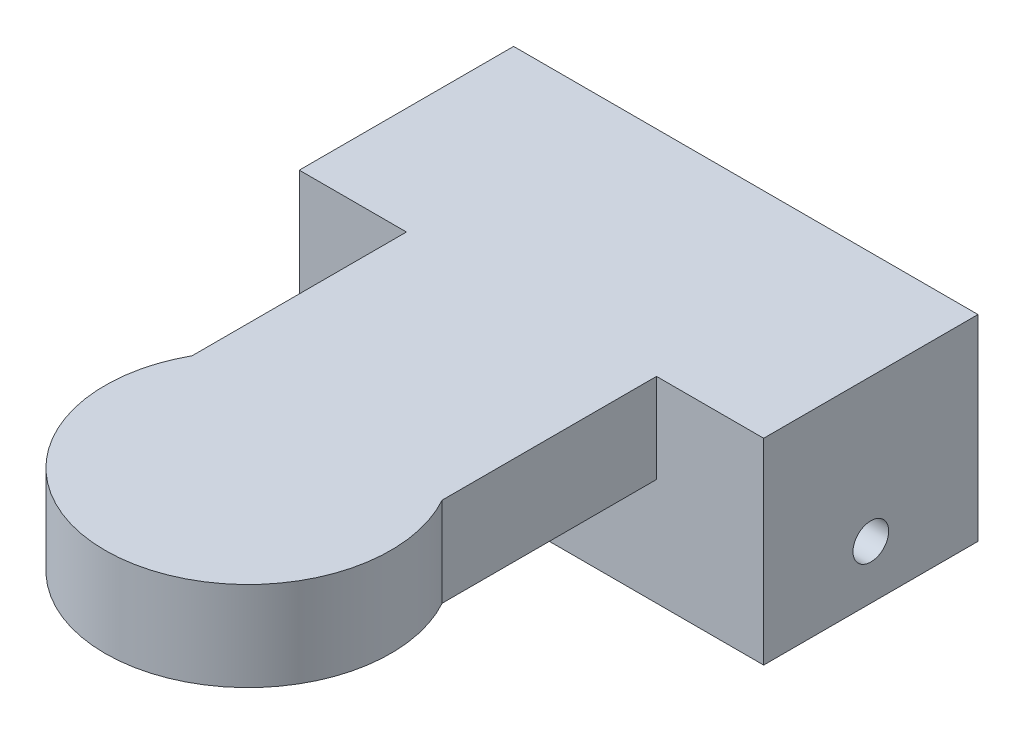
from build123d import *

# Parameters (mm, degrees)
SKETCH1_R                = 20
BOSS_EXTRUDE1_DEPTH      = 10
CUT_EXTRUDE1_DEPTH       = 31
BOSS_EXTRUDE2_DEPTH      = 10
SKETCH5_R                = 12.5
BOSS_EXTRUDE3_DEPTH      = 6
BOSS_EXTRUDE4_DEPTH      = 10
BOSS_EXTRUDE4_DEPTH_BACK = 20
SKETCH7_R                = 2.5
CUT_EXTRUDE2_DEPTH       = 97.465771152
BOSS_EXTRUDE5_DEPTH      = 2.5
CUT_EXTRUDE3_START       = -2.5
SKETCH9_R                = 12.5
CUT_EXTRUDE3_DEPTH       = 2.5
SKETCH10_W               = 45
SKETCH10_H               = 15
BOSS_EXTRUDE6_DEPTH      = 9.95
SKETCH11_W               = 45
SKETCH11_H               = 15
BOSS_EXTRUDE7_DEPTH      = 9.95
SKETCH12_R               = 47.5
CUT_EXTRUDE4_DEPTH       = 10


with BuildPart() as part:
    # Sketch1 → Boss-Extrude1 (new body)
    with BuildSketch(Plane(origin=(0, 0, 0), x_dir=(1, 0, 0), z_dir=(0, 1, 0))):
        with Locations(Location((0, 0, 0), (0, 0, 270))):
            Circle(SKETCH1_R)
    extrude(amount=BOSS_EXTRUDE1_DEPTH)

    # Sketch2 → Cut-Extrude1 (cut, through all)
    with BuildSketch(Plane(origin=(0, 10, 0), x_dir=(1, 0, 0), z_dir=(0, 1, 0))):
        with BuildLine():
            Line((1.962141687, 3.6), (-1.962141687, 3.6))
            ThreePointArc((-1.962141687, 3.6), (-3.686980014, 1.793370675), (-4.043407712, -0.678862337))
            ThreePointArc((-4.043407712, -0.678862337), (-2.899137803, -2.899137803), (-0.678862337, -4.043407712))
            ThreePointArc((-0.678862337, -4.043407712), (1.793370675, -3.686980014), (3.6, -1.962141687))
            Line((3.6, -1.962141687), (3.6, 1.962141687))
            ThreePointArc((3.6, 1.962141687), (2.899137803, 2.899137803), (1.962141687, 3.6))
        make_face()
    extrude(amount=-CUT_EXTRUDE1_DEPTH, mode=Mode.SUBTRACT)

    # Sketch3 → Boss-Extrude2 (add)
    with BuildSketch(Plane(origin=(0, 0, 0), x_dir=(1, 0, 0), z_dir=(0, 1, 0))):
        with BuildLine():
            Line((-17.5, 59.682458366), (-17.5, 9.682458366))
            ThreePointArc((-17.5, 9.682458366), (0, 20), (17.5, 9.682458366))
            Line((17.5, 9.682458366), (17.5, 59.682458366))
            Line((17.5, 59.682458366), (-17.5, 59.682458366))
        make_face()
    extrude(amount=BOSS_EXTRUDE2_DEPTH)

    # Sketch5 → Boss-Extrude3 (add)
    with BuildSketch(Plane.XZ):
        with Locations(Location((0, 0, 0), (0, 0, 90))):
            Circle(SKETCH5_R)
        with BuildLine():
            Line((3.6, 1.962141687), (3.6, -1.962141687))
            ThreePointArc((3.6, -1.962141687), (2.899137803, -2.899137803), (1.962141687, -3.6))
            Line((1.962141687, -3.6), (-1.962141687, -3.6))
            ThreePointArc((-1.962141687, -3.6), (-2.899137803, 2.899137803), (3.6, 1.962141687))
        make_face(mode=Mode.SUBTRACT)
    extrude(amount=BOSS_EXTRUDE3_DEPTH)

    # Sketch6 → Boss-Extrude4 (add, two sides: drawn at the far end of the back side and taken through both)
    with BuildSketch(Plane(origin=(0, 0, -59.682458366), x_dir=(-1, 0, 0), z_dir=(0, 0, -1)).offset(-BOSS_EXTRUDE4_DEPTH_BACK)):
        Polygon((-32.5, 10), (32.5, 10), (32.5, -15), (22.5, -15), (22.5, 0), (-22.5, 0), (-22.5, -15), (-32.5, -15), align=None)
    extrude(amount=BOSS_EXTRUDE4_DEPTH + BOSS_EXTRUDE4_DEPTH_BACK)

    # Sketch7 → Cut-Extrude2 (cut, through all)
    with BuildSketch(Plane(origin=(32.5, 0, 0), x_dir=(0, 0, -1), z_dir=(1, 0, 0))):
        with Locations(Location((54.682458366, -7.5, 0), (0, 0, 90))):
            Circle(SKETCH7_R)
    extrude(amount=-CUT_EXTRUDE2_DEPTH, mode=Mode.SUBTRACT)

    # Sketch8 → Boss-Extrude5 (add)
    with BuildSketch(Plane(origin=(0, 10, 0), x_dir=(1, 0, 0), z_dir=(0, 1, 0))):
        with BuildLine():
            Line((-32.5, 69.682458366), (-32.5, 39.682458366))
            Line((-32.5, 39.682458366), (-17.5, 39.682458366))
            Line((-17.5, 39.682458366), (-17.5, 9.682458366))
            ThreePointArc((-17.5, 9.682458366), (0, -20), (17.5, 9.682458366))
            Line((17.5, 9.682458366), (17.5, 39.682458366))
            Line((17.5, 39.682458366), (32.5, 39.682458366))
            Line((32.5, 39.682458366), (32.5, 69.682458366))
            Line((32.5, 69.682458366), (-32.5, 69.682458366))
        make_face()
    extrude(amount=BOSS_EXTRUDE5_DEPTH)

    # Sketch9 → Cut-Extrude3 (cut)
    with BuildSketch(Plane.XZ.offset(6).offset(CUT_EXTRUDE3_START)):
        with Locations(Location((0, 0, 0), (0, 0, 90))):
            Circle(SKETCH9_R)
    extrude(amount=CUT_EXTRUDE3_DEPTH, mode=Mode.SUBTRACT)

    # Sketch10 → Boss-Extrude6 (add)
    with BuildSketch(Plane(origin=(0, 0, -69.682458366), x_dir=(-1, 0, 0), z_dir=(0, 0, -1))):
        with Locations((0, -7.5)):
            Rectangle(SKETCH10_W, SKETCH10_H)
    extrude(amount=-BOSS_EXTRUDE6_DEPTH)

    # Sketch11 → Boss-Extrude7 (add)
    with BuildSketch(Plane.XY.offset(-39.682458366)):
        with Locations((0, -7.5)):
            Rectangle(SKETCH11_W, SKETCH11_H)
    extrude(amount=-BOSS_EXTRUDE7_DEPTH)

    # Sketch12 → Cut-Extrude4 (cut)
    with BuildSketch(Plane(origin=(0, 0, -69.682458366), x_dir=(-1, 0, 0), z_dir=(0, 0, -1))):
        with Locations((0, -60)):
            Circle(SKETCH12_R)
    extrude(amount=-CUT_EXTRUDE4_DEPTH, mode=Mode.SUBTRACT)


solid = part.part
